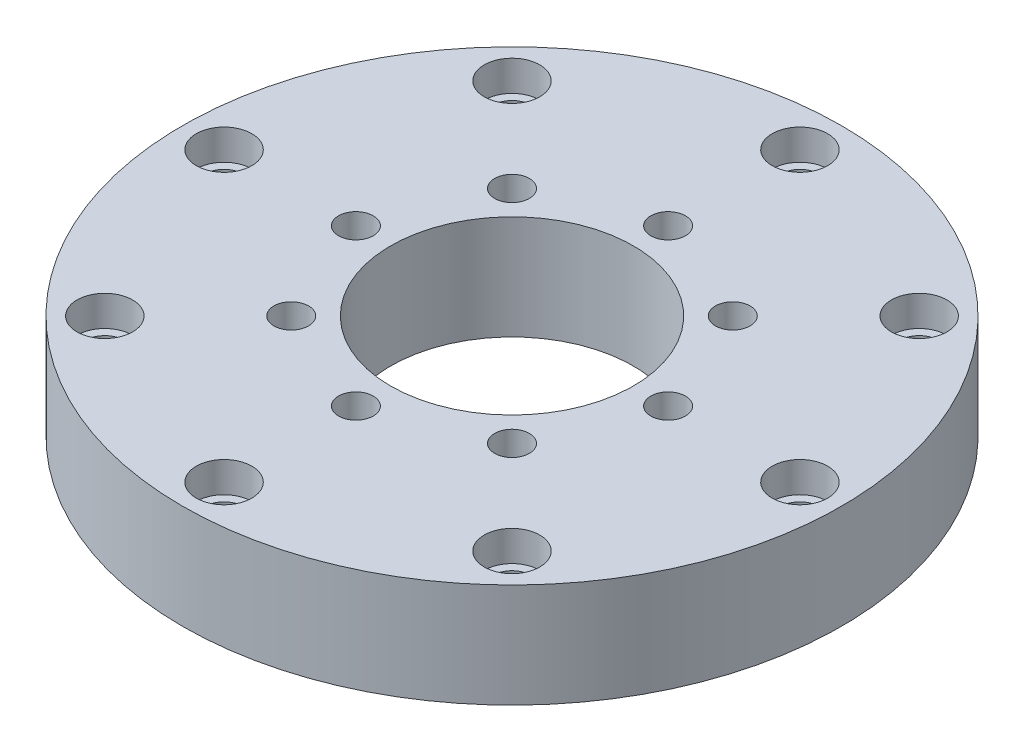
from build123d import *

# Parameters (mm, degrees)
SKETCH1_R                               = 47.5
SKETCH1_R_2                             = 17.5
SKETCH1_R_3                             = 2.75
SKETCH1_R_4                             = 2.5
BOSS_EXTRUDE1_DEPTH                     = 15
CBORE_FOR_M5_HEX_HEAD_BOLT4_D           = 4.5
CBORE_FOR_M5_HEX_HEAD_BOLT4_CBORE_D     = 8
CBORE_FOR_M5_HEX_HEAD_BOLT4_CBORE_DEPTH = 4.4


with BuildPart() as part:
    # Sketch1 → Boss-Extrude1 (new body)
    with BuildSketch(Plane(origin=(0, 0, 0), x_dir=(1, 0, 0), z_dir=(0, 1, 0))):
        with Locations(Location((0, 0, 0), (0, 0, 270))):
            Circle(SKETCH1_R)
        with Locations(Location((0, 0, 0), (0, 0, 270))):
            Circle(SKETCH1_R_2, mode=Mode.SUBTRACT)
        with Locations(Location((0, 41.5, 0), (0, 0, 270))):
            Circle(SKETCH1_R_3, mode=Mode.SUBTRACT)
        with Locations(Location((29.344931419, 29.344931419, 0), (0, 0, 270))):
            Circle(SKETCH1_R_3, mode=Mode.SUBTRACT)
        with Locations(Location((41.5, 0, 0), (0, 0, 270))):
            Circle(SKETCH1_R_3, mode=Mode.SUBTRACT)
        with Locations(Location((29.344931419, -29.344931419, 0), (0, 0, 270))):
            Circle(SKETCH1_R_3, mode=Mode.SUBTRACT)
        with Locations(Location((0, -41.5, 0), (0, 0, 270))):
            Circle(SKETCH1_R_3, mode=Mode.SUBTRACT)
        with Locations(Location((-29.344931419, -29.344931419, 0), (0, 0, 270))):
            Circle(SKETCH1_R_3, mode=Mode.SUBTRACT)
        with Locations(Location((-41.5, 0, 0), (0, 0, 270))):
            Circle(SKETCH1_R_3, mode=Mode.SUBTRACT)
        with Locations(Location((-29.344931419, 29.344931419, 0), (0, 0, 270))):
            Circle(SKETCH1_R_3, mode=Mode.SUBTRACT)
        with Locations(Location((0, 22.5, 0), (0, 0, 270))):
            Circle(SKETCH1_R_4, mode=Mode.SUBTRACT)
        with Locations(Location((15.909902577, 15.909902577, 0), (0, 0, 270))):
            Circle(SKETCH1_R_4, mode=Mode.SUBTRACT)
        with Locations(Location((22.5, 0, 0), (0, 0, 270))):
            Circle(SKETCH1_R_4, mode=Mode.SUBTRACT)
        with Locations(Location((15.909902577, -15.909902577, 0), (0, 0, 270))):
            Circle(SKETCH1_R_4, mode=Mode.SUBTRACT)
        with Locations(Location((0, -22.5, 0), (0, 0, 270))):
            Circle(SKETCH1_R_4, mode=Mode.SUBTRACT)
        with Locations(Location((-15.909902577, -15.909902577, 0), (0, 0, 270))):
            Circle(SKETCH1_R_4, mode=Mode.SUBTRACT)
        with Locations(Location((-22.5, 0, 0), (0, 0, 270))):
            Circle(SKETCH1_R_4, mode=Mode.SUBTRACT)
        with Locations(Location((-15.909902577, 15.909902577, 0), (0, 0, 270))):
            Circle(SKETCH1_R_4, mode=Mode.SUBTRACT)
    extrude(amount=BOSS_EXTRUDE1_DEPTH)

    # CBORE for M5 Hex Head Bolt4 (through all)
    with Locations(Plane(origin=(0, 15, -41.5), x_dir=(0, 0, 1), z_dir=(0, 1, 0))):
        with Locations((0, 0), (12.155068581, 29.344931419), (41.5, 41.5), (70.844931419, 29.344931419), (83, 0), (70.844931419, -29.344931419), (41.5, -41.5), (12.155068581, -29.344931419)):
            CounterBoreHole(CBORE_FOR_M5_HEX_HEAD_BOLT4_D / 2, CBORE_FOR_M5_HEX_HEAD_BOLT4_CBORE_D / 2, CBORE_FOR_M5_HEX_HEAD_BOLT4_CBORE_DEPTH)


solid = part.part
